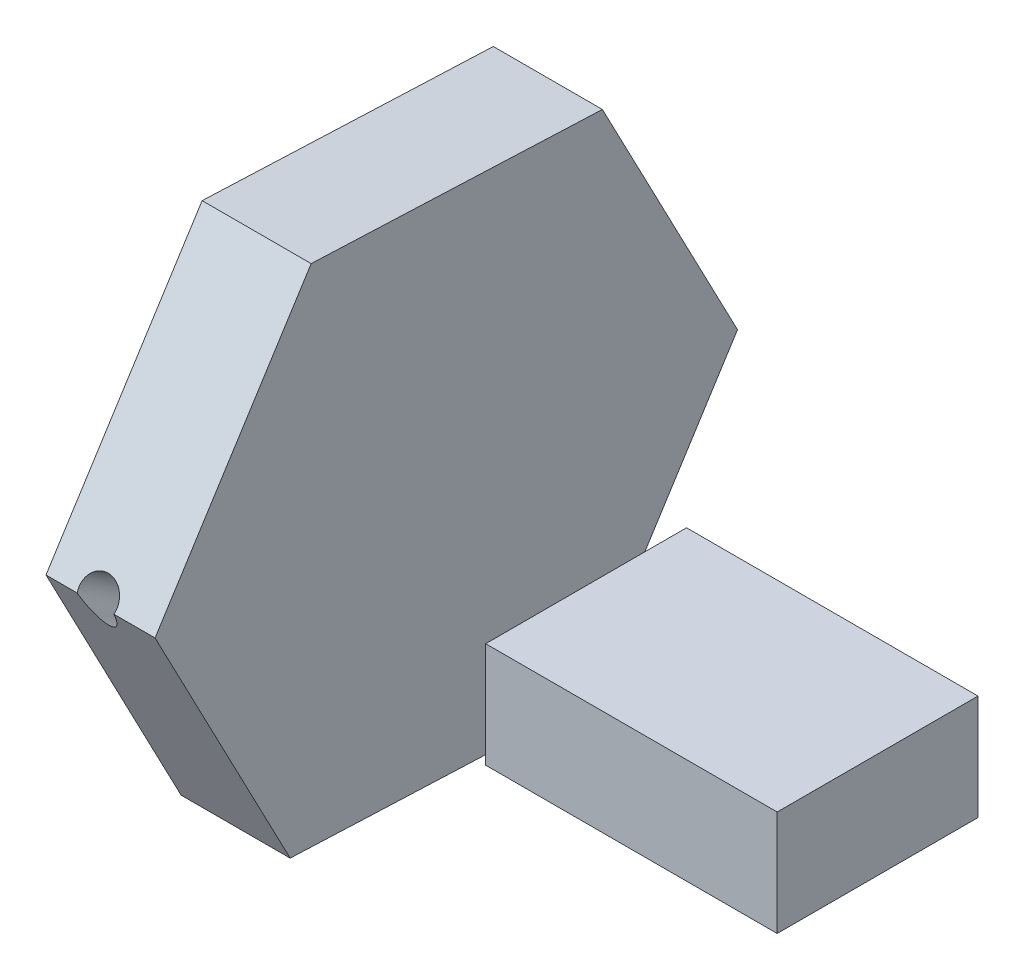
from build123d import *

# Parameters (mm, degrees)
SKETCH1_W           = 210.00243261
SKETCH1_H           = 110.05666017
BOSS_EXTRUDE1_DEPTH = 304.8
BOSS_EXTRUDE2_DEPTH = 114.046
SKETCH3_R           = 19.847146284
CUT_EXTRUDE1_DEPTH  = 737.439597843


with BuildPart() as part:
    # Sketch1 → Boss-Extrude1 (new body)
    with BuildSketch(Plane(origin=(0, 0, 0), x_dir=(0, 0, -1), z_dir=(1, 0, 0))):
        with Locations((-6.76044486, 15.847323966)):
            Rectangle(SKETCH1_W, SKETCH1_H)
    extrude(amount=BOSS_EXTRUDE1_DEPTH)


with BuildPart() as body_2:
    # Sketch2 → Boss-Extrude2 (new body)
    with BuildSketch(Plane(origin=(0, 0, 0), x_dir=(0, 0, -1), z_dir=(1, 0, 0))):
        Polygon((10.24911483, 493.70040749), (-294.287810867, 506.361406154), (-457.521020196, 248.955191443), (-316.217303829, -21.112021933), (-11.680378132, -33.773020598), (151.552831197, 223.633194114), align=None)
    extrude(amount=-BOSS_EXTRUDE2_DEPTH)

    # Sketch3 → Cut-Extrude1 (cut, through all)
    with BuildSketch(Plane(origin=(0, 278.324614741, 438.896507861), x_dir=(1, 0, 0), z_dir=(0, 0.5355420253583275, 0.8445085784496807))):
        with Locations(Location((-62.264120874, -29.827827888, 0), (0, 0, 194.439723092))):
            Circle(SKETCH3_R)
    extrude(amount=-CUT_EXTRUDE1_DEPTH, mode=Mode.SUBTRACT)


solid = Compound([part.part, body_2.part])
